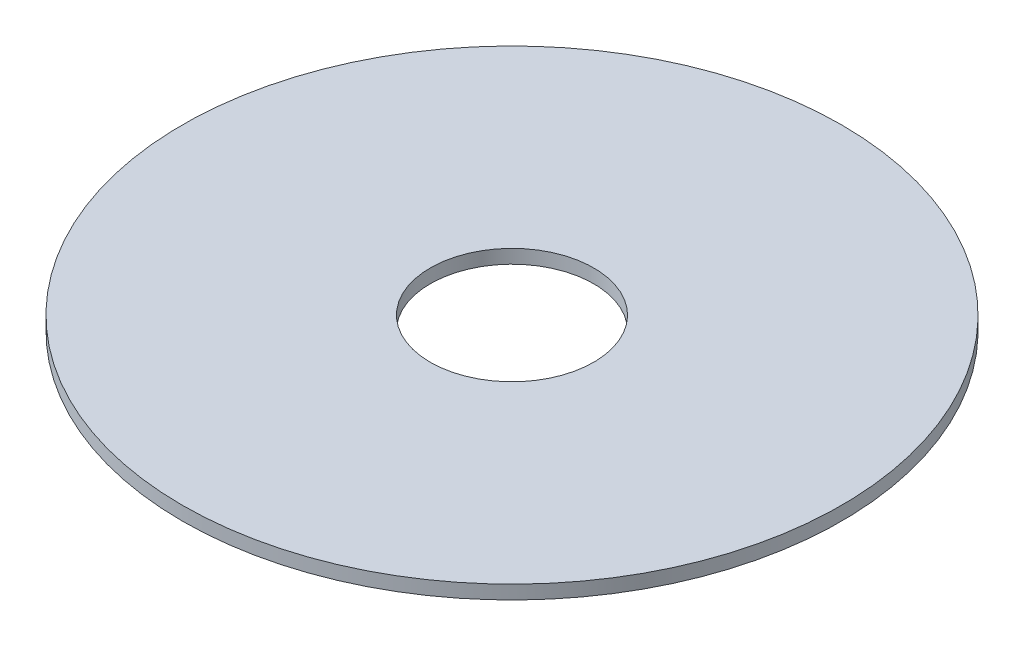
from build123d import *

# Parameters (mm, degrees)
SKETCH1_R           = 38.1
SKETCH1_R_2         = 9.4488
BOSS_EXTRUDE1_DEPTH = 1.5875


with BuildPart() as part:
    # Sketch1 → Boss-Extrude1 (new body)
    with BuildSketch(Plane(origin=(0, 0, 0), x_dir=(1, 0, 0), z_dir=(0, 1, 0))):
        with Locations(Location((0, 0, 0), (0, 0, 270))):
            Circle(SKETCH1_R)
        with Locations(Location((0, 0, 0), (0, 0, 270))):
            Circle(SKETCH1_R_2, mode=Mode.SUBTRACT)
    extrude(amount=BOSS_EXTRUDE1_DEPTH)


solid = part.part
